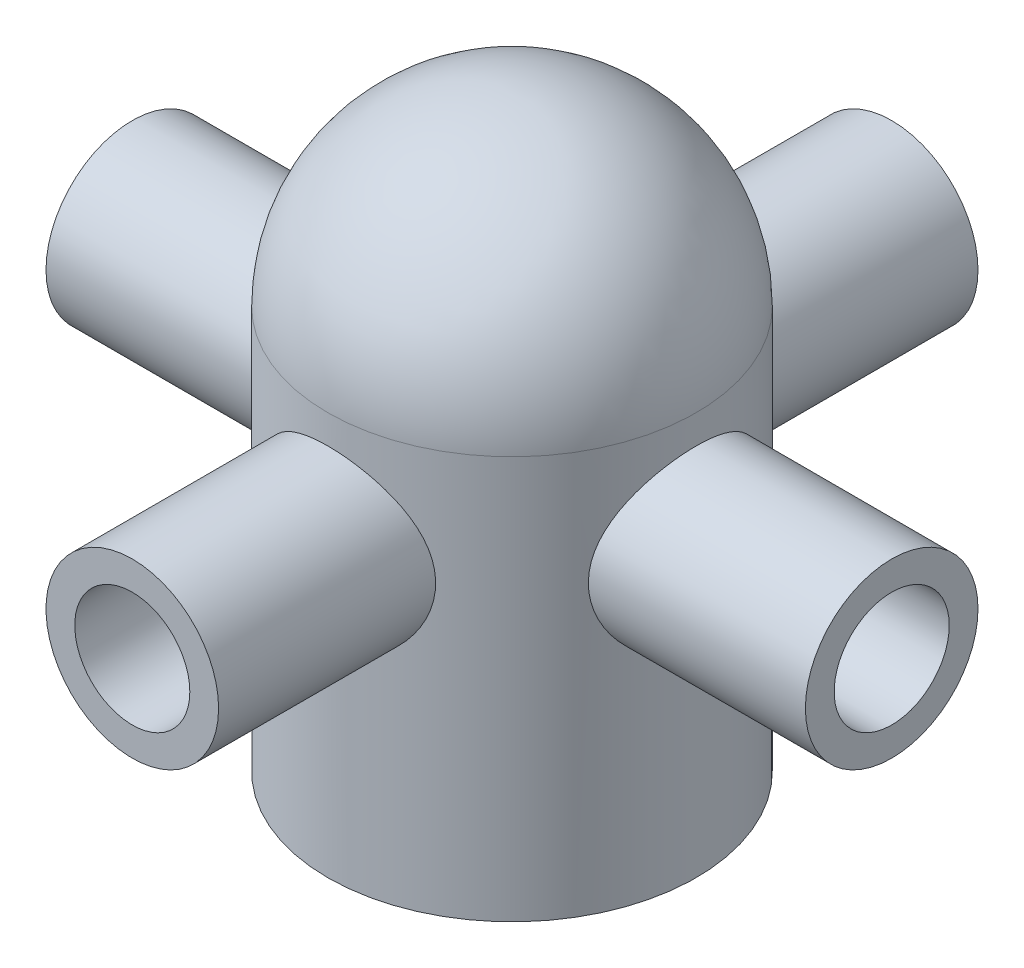
from build123d import *

# Parameters (mm, degrees)
SKETCH_3_R               = 7.5
EXTRUDE_2_DEPTH          = 33
SKETCH_4_R               = 5
CUT_EXTRUDE_1_DEPTH      = 15
PATTERN_CIRCULAR_2_COUNT = 4


with BuildPart() as part:
    # 草图2 → 旋转2 (revolve)
    with BuildSketch(Plane.XY, mode=Mode.PRIVATE) as revolve_2_sk:
        with BuildLine():
            Line((-16, 0), (-16, -35))
            Line((-16, -35), (-14, -35))
            Line((-14, -35), (-14, 0))
            Line((-14, 0), (0, 0))
            Line((0, 0), (0, 16))
            ThreePointArc((0, 16), (-11.313708499, 11.313708499), (-16, 0))
        make_face()
    revolve(revolve_2_sk.sketch.rotate(Axis((0, 0, 0), (0, -1, 0)), 270), axis=Axis((0, 0, 0), (0, -1, 0)))

    # 草图3 → 凸台-拉伸2 (add)
    with BuildSketch(Plane.XY):
        with Locations(Location((0, -10, 0), (0, 0, 90.000000001))):
            Circle(SKETCH_3_R)
    extrude_2 = extrude(amount=EXTRUDE_2_DEPTH)

    # 草图4 → 切除-拉伸1 (cut)
    with BuildSketch(Plane.XY.offset(33)):
        with Locations((0, -10)):
            Circle(SKETCH_4_R)
    cut_extrude_1 = extrude(amount=-CUT_EXTRUDE_1_DEPTH, mode=Mode.SUBTRACT)

    # 阵列(圆周)2: 凸台-拉伸2, 切除-拉伸1 ×4 about axis
    pattern_circular_2_axis = Axis((0, 0, 0), (0, 1, 0))
    add([extrude_2.rotate(pattern_circular_2_axis, i * 360 / PATTERN_CIRCULAR_2_COUNT) for i in range(1, PATTERN_CIRCULAR_2_COUNT)])
    add([cut_extrude_1.rotate(pattern_circular_2_axis, i * 360 / PATTERN_CIRCULAR_2_COUNT) for i in range(1, PATTERN_CIRCULAR_2_COUNT)], mode=Mode.SUBTRACT)


solid = part.part
